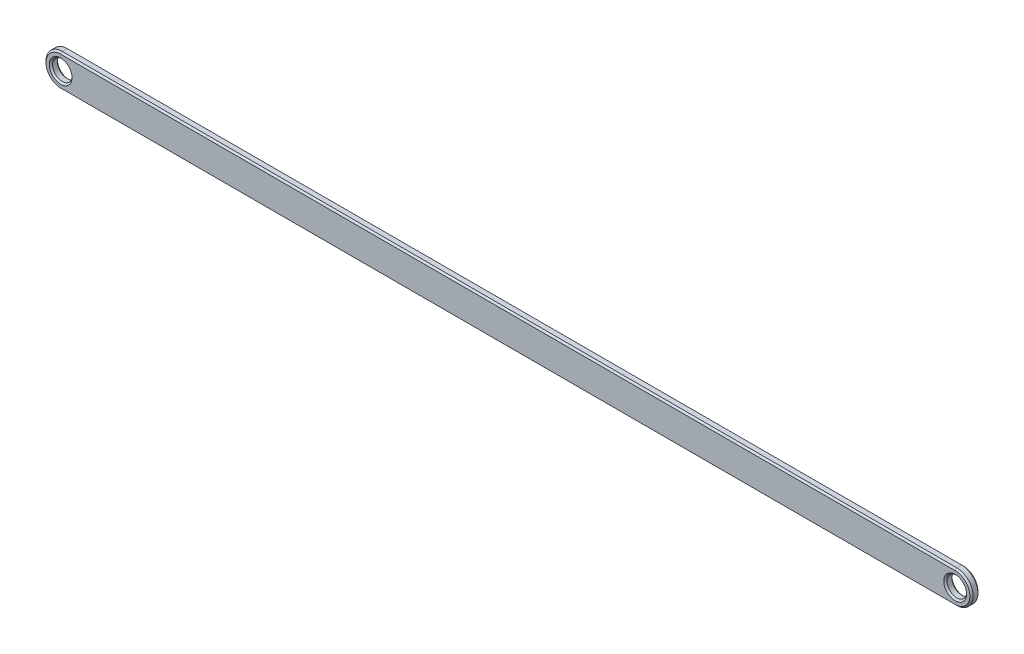
from build123d import *

# Parameters (mm, degrees)
SKETCH1_R           = 30
BOSS_EXTRUDE1_DEPTH = 25
CHAMFER1_SIZE       = 5


with BuildPart() as part:
    # Sketch1 → Boss-Extrude1 (new body)
    with BuildSketch(Plane.XY):
        with BuildLine():
            Line((1372.5, -50), (-1372.5, -50))
            ThreePointArc((-1372.5, -50), (-1422.5, 0), (-1372.5, 50))
            Line((-1372.5, 50), (1372.5, 50))
            ThreePointArc((1372.5, 50), (1422.5, 0), (1372.5, -50))
        make_face()
        with Locations((-1372.5, 0)):
            Circle(SKETCH1_R, mode=Mode.SUBTRACT)
        with Locations(Location((1372.5, 0, 0), (0, 0, 180))):
            Circle(SKETCH1_R, mode=Mode.SUBTRACT)
    extrude(amount=BOSS_EXTRUDE1_DEPTH)

    # Chamfer1
    chamfer1_edges = [part.edges().sort_by_distance(p)[0] for p in [
        (1422.5, 0, 25),
        (-1402.5, 0, 0),
        (-1402.5, 0, 25),
        (0, 50, 25),
        (1402.5, 0, 0),
        (1402.5, 0, 25),
        (-1422.5, 0, 25),
        (0, 50, 0),
        (1422.5, 0, 0),
        (0, -50, 0),
        (-1422.5, 0, 0),
        (0, -50, 25),
    ]]
    chamfer(chamfer1_edges, length=CHAMFER1_SIZE)


solid = part.part
